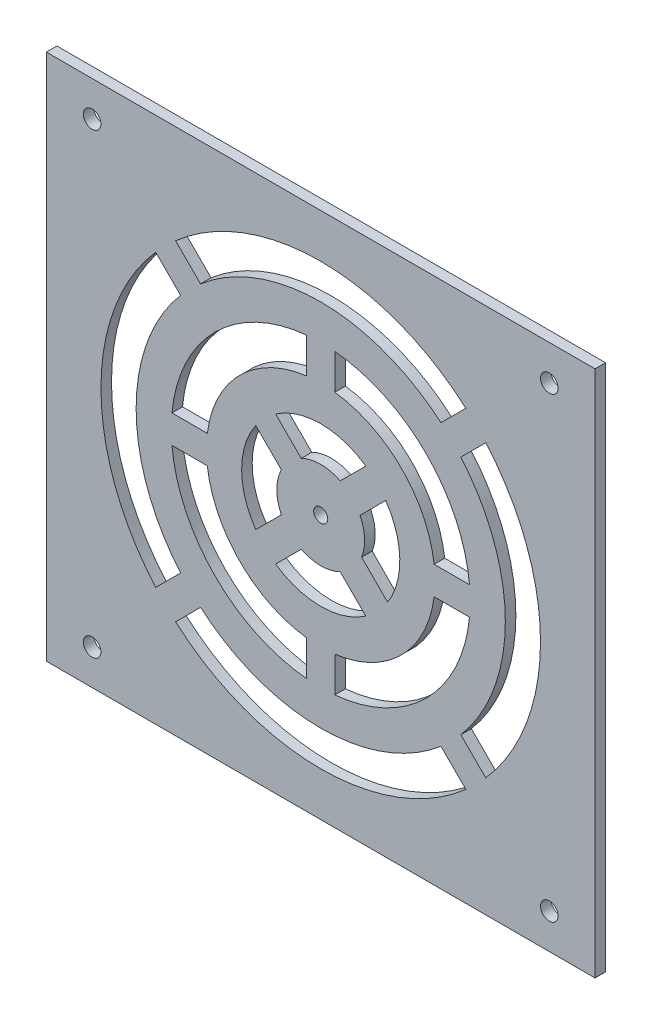
from build123d import *

# Parameters (mm, degrees)
SKETCH1_W           = 150
SKETCH1_H           = 150
BOSS_EXTRUDE1_DEPTH = 3
CUT_EXTRUDE1_DEPTH  = 264.0332057
SKETCH4_R           = 2.5
CUT_EXTRUDE2_DEPTH  = 3
SKETCH5_W           = 3
SKETCH5_H           = 150
BOSS_EXTRUDE2_DEPTH = 3
SKETCH6_R           = 2
CUT_EXTRUDE3_DEPTH  = 10


with BuildPart() as part:
    # Sketch1 → Boss-Extrude1 (new body)
    with BuildSketch(Plane.XY):
        with Locations((146.896551724, 66.206896552)):
            Rectangle(SKETCH1_W, SKETCH1_H)
    extrude(amount=BOSS_EXTRUDE1_DEPTH)

    # Sketch2 → Cut-Extrude1 (cut, through all)
    with BuildSketch(Plane.XY.offset(3)):
        with BuildLine():
            ThreePointArc((188.163122783, 113.13032186), (146.896551724, 128.694797217), (105.629980666, 113.13032186))
            Line((105.629980666, 113.13032186), (112.718359737, 106.041942789))
            ThreePointArc((112.718359737, 106.041942789), (146.896551724, 118.694797217), (181.074743712, 106.041942789))
            Line((181.074743712, 106.041942789), (188.163122783, 113.13032186))
        make_face()
        with BuildLine():
            Line((107.061505487, 100.385088539), (99.973126416, 107.47346761))
            ThreePointArc((99.973126416, 107.47346761), (84.408651059, 66.206896552), (99.973126416, 24.940325493))
            Line((99.973126416, 24.940325493), (107.061505487, 32.028704564))
            ThreePointArc((107.061505487, 32.028704564), (94.408651059, 66.206896552), (107.061505487, 100.385088539))
        make_face()
        with BuildLine():
            ThreePointArc((209.384452389, 66.206896552), (205.363995952, 88.259009716), (193.819977032, 107.47346761))
            Line((193.819977032, 107.47346761), (186.731597961, 100.385088539))
            ThreePointArc((186.731597961, 100.385088539), (196.119705149, 84.429434333), (199.384452389, 66.206896552))
            ThreePointArc((199.384452389, 66.206896552), (196.119705149, 47.984358771), (186.731597961, 32.028704564))
            Line((186.731597961, 32.028704564), (193.819977032, 24.940325493))
            ThreePointArc((193.819977032, 24.940325493), (205.363995952, 44.154783387), (209.384452389, 66.206896552))
        make_face()
        with BuildLine():
            Line((112.718359737, 26.371850315), (105.629980666, 19.283471244))
            ThreePointArc((105.629980666, 19.283471244), (146.896551724, 3.718995886), (188.163122783, 19.283471244))
            Line((188.163122783, 19.283471244), (181.074743712, 26.371850315))
            ThreePointArc((181.074743712, 26.371850315), (146.896551724, 13.718995886), (112.718359737, 26.371850315))
        make_face()
        with BuildLine():
            ThreePointArc((150.896551724, 23.907703853), (176.940034403, 36.163413873), (189.195744423, 62.206896552))
            Line((189.195744423, 62.206896552), (179.137266506, 62.206896552))
            ThreePointArc((179.137266506, 62.206896552), (169.868966591, 43.234481685), (150.896551724, 33.96618177))
            Line((150.896551724, 33.96618177), (150.896551724, 23.907703853))
        make_face()
        with BuildLine():
            Line((114.655836942, 62.206896552), (104.597359026, 62.206896552))
            ThreePointArc((104.597359026, 62.206896552), (116.853069045, 36.163413873), (142.896551724, 23.907703853))
            Line((142.896551724, 23.907703853), (142.896551724, 33.96618177))
            ThreePointArc((142.896551724, 33.96618177), (123.924136857, 43.234481685), (114.655836942, 62.206896552))
        make_face()
        with BuildLine():
            Line((142.896551724, 98.447611333), (142.896551724, 108.50608925))
            ThreePointArc((142.896551724, 108.50608925), (116.853069045, 96.250379231), (104.597359026, 70.206896552))
            Line((104.597359026, 70.206896552), (114.655836942, 70.206896552))
            ThreePointArc((114.655836942, 70.206896552), (123.924136857, 89.179311419), (142.896551724, 98.447611333))
        make_face()
        with BuildLine():
            ThreePointArc((189.195744423, 70.206896552), (176.940034403, 96.250379231), (150.896551724, 108.50608925))
            Line((150.896551724, 108.50608925), (150.896551724, 98.447611333))
            ThreePointArc((150.896551724, 98.447611333), (169.868966591, 89.179311419), (179.137266506, 70.206896552))
            Line((179.137266506, 70.206896552), (189.195744423, 70.206896552))
        make_face()
        with BuildLine():
            Line((165.372753073, 79.026243651), (158.090015102, 71.74350568))
            ThreePointArc((158.090015102, 71.74350568), (159.056537781, 69.049853135), (159.384452389, 66.206896552))
            ThreePointArc((159.384452389, 66.206896552), (159.166880972, 63.885973637), (158.521748029, 61.645923641))
            Line((158.521748029, 61.645923641), (165.932760465, 54.234911206))
            ThreePointArc((165.932760465, 54.234911206), (168.504305512, 59.977076926), (169.384452389, 66.206896552))
            ThreePointArc((169.384452389, 66.206896552), (168.358106385, 72.923096956), (165.372753073, 79.026243651))
        make_face()
        with BuildLine():
            Line((134.077204625, 84.6830979), (141.359942596, 77.400359929))
            ThreePointArc((141.359942596, 77.400359929), (146.896551724, 78.694797217), (152.433160852, 77.400359929))
            Line((152.433160852, 77.400359929), (159.715898823, 84.6830979))
            ThreePointArc((159.715898823, 84.6830979), (146.896551724, 88.694797217), (134.077204625, 84.6830979))
        make_face()
        with BuildLine():
            ThreePointArc((135.703088346, 60.670287424), (134.408651059, 66.206896552), (135.703088346, 71.74350568))
            Line((135.703088346, 71.74350568), (128.420350375, 79.026243651))
            ThreePointArc((128.420350375, 79.026243651), (124.408651059, 66.206896552), (128.420350375, 53.387549452))
            Line((128.420350375, 53.387549452), (135.703088346, 60.670287424))
        make_face()
        with BuildLine():
            ThreePointArc((152.433160852, 55.013433174), (146.896551724, 53.718995886), (141.359942596, 55.013433174))
            Line((141.359942596, 55.013433174), (134.077204625, 47.730695203))
            ThreePointArc((134.077204625, 47.730695203), (146.896551724, 43.718995886), (159.715898823, 47.730695203))
            Line((159.715898823, 47.730695203), (152.433160852, 55.013433174))
        make_face()
    extrude(amount=-CUT_EXTRUDE1_DEPTH, mode=Mode.SUBTRACT)

    # Sketch4 → Cut-Extrude2 (cut)
    with BuildSketch(Plane.XY.offset(3)):
        with Locations((81.896551724, 131.206896552)):
            Circle(SKETCH4_R)
        with Locations((211.896551724, 131.206896552)):
            Circle(SKETCH4_R)
        with Locations((211.896551724, 1.206896552)):
            Circle(SKETCH4_R)
        with Locations((81.896551724, 1.206896552)):
            Circle(SKETCH4_R)
    extrude(amount=-CUT_EXTRUDE2_DEPTH, mode=Mode.SUBTRACT)

    # Sketch5 → Boss-Extrude2 (add)
    with BuildSketch(Plane(origin=(0, 0, 0), x_dir=(-1, 0, 0), z_dir=(0, 0, -1))):
        with Locations((-223.396551724, 66.206896552)):
            Rectangle(SKETCH5_W, SKETCH5_H)
        with Locations((-70.396551724, 66.206896552)):
            Rectangle(SKETCH5_W, SKETCH5_H)
    extrude(amount=-BOSS_EXTRUDE2_DEPTH)

    # Sketch6 → Cut-Extrude3 (cut)
    with BuildSketch(Plane.XY.offset(3)):
        with Locations((146.896551724, 66.206896552)):
            Circle(SKETCH6_R)
    extrude(amount=-CUT_EXTRUDE3_DEPTH, mode=Mode.SUBTRACT)


solid = part.part
